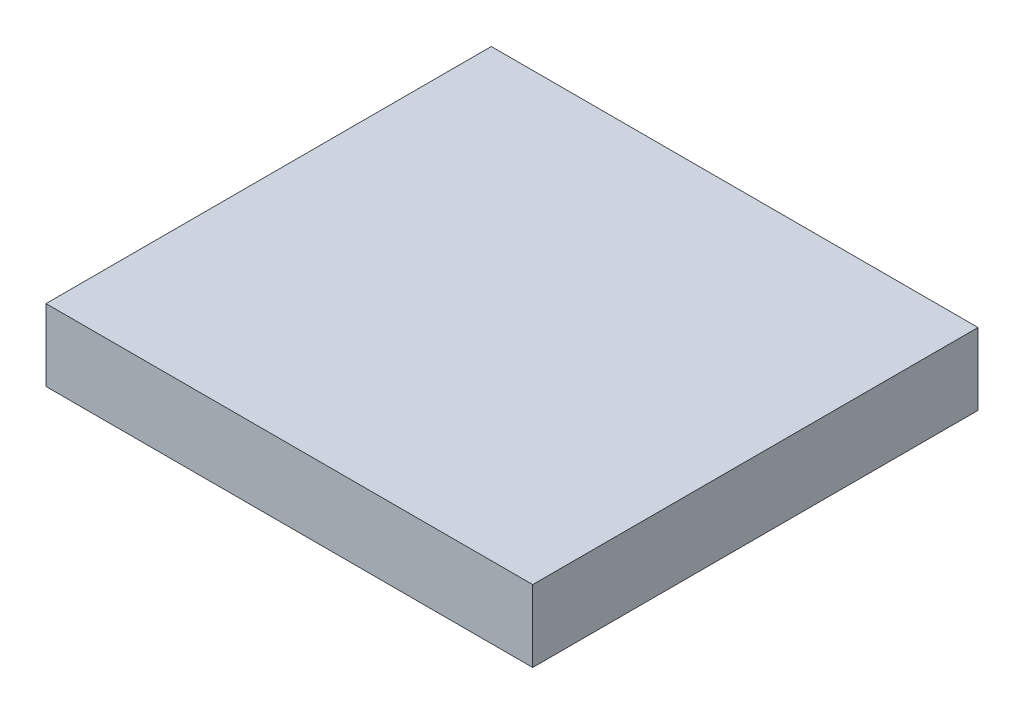
from build123d import *

# Parameters (mm, degrees)
SKETCH1_W           = 67.763022898
SKETCH1_H           = 62
BOSS_EXTRUDE1_DEPTH = 10


with BuildPart() as part:
    # Sketch1 → Boss-Extrude1 (new body)
    with BuildSketch(Plane(origin=(0, 0, 0), x_dir=(1, 0, 0), z_dir=(0, 1, 0))):
        Rectangle(SKETCH1_W, SKETCH1_H)
    extrude(amount=BOSS_EXTRUDE1_DEPTH)


solid = part.part
